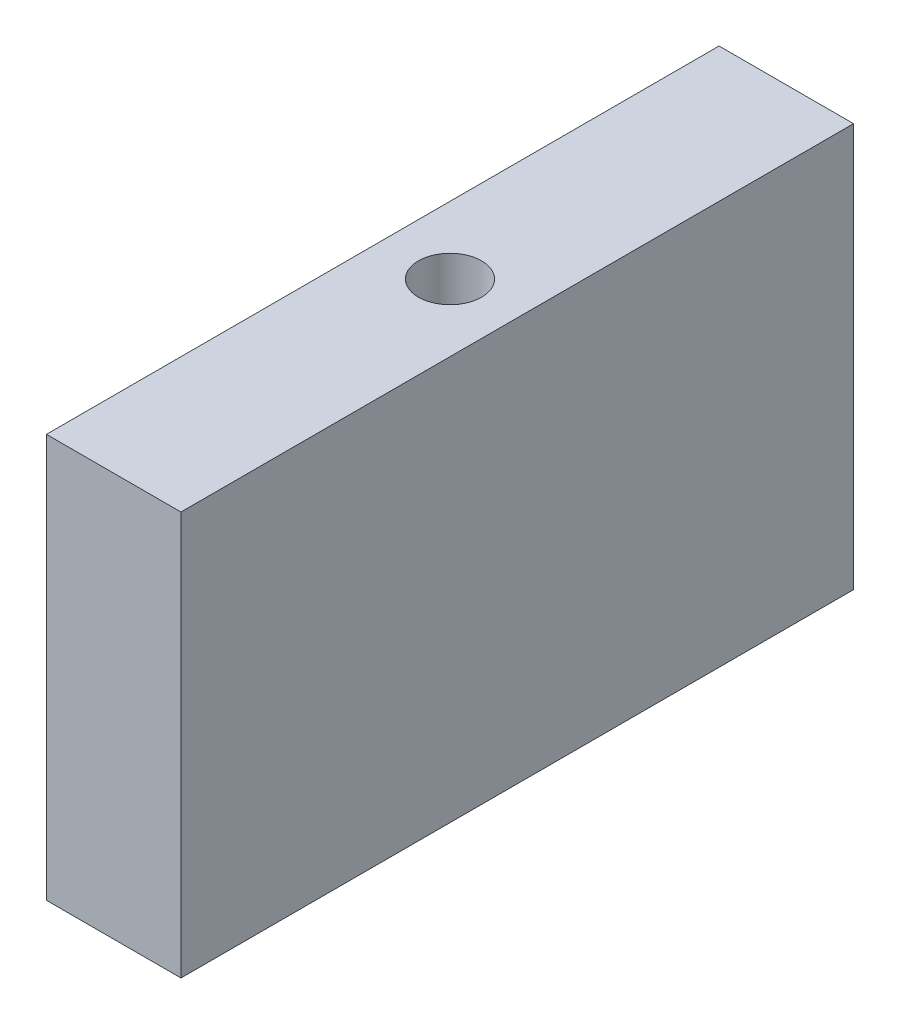
from build123d import *

# Parameters (mm, degrees)
SKETCH1_W             = 2.54
SKETCH1_H             = 12.7
BOSS_EXTRUDE1_DEPTH   = 7.62
F_0_80_TAPPED_HOLE1_D = 1.19126


with BuildPart() as part:
    # Sketch1 → Boss-Extrude1 (new body)
    with BuildSketch(Plane(origin=(0, 0, 0), x_dir=(1, 0, 0), z_dir=(0, 1, 0))):
        Rectangle(SKETCH1_W, SKETCH1_H)
    extrude(amount=BOSS_EXTRUDE1_DEPTH)

    # #0-80 Tapped Hole1 (through all)
    with Locations(Plane(origin=(0, 7.62, 0), x_dir=(1, 0, 0), z_dir=(0, 1, 0))):
        with Locations((0, 0)):
            Hole(F_0_80_TAPPED_HOLE1_D / 2)


solid = part.part
